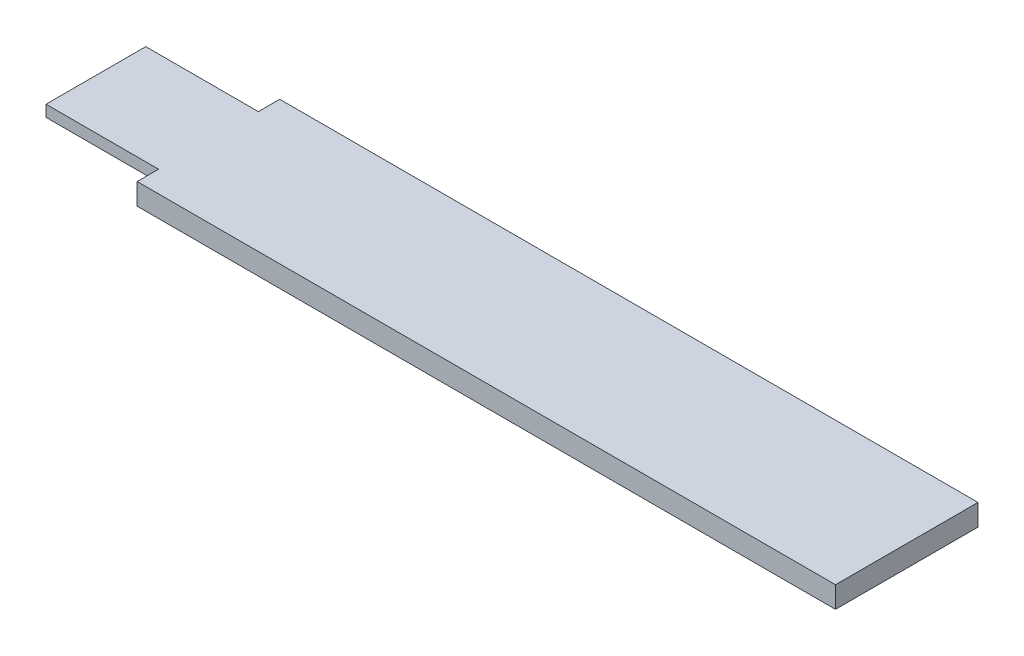
from build123d import *

# Parameters (mm, degrees)
EXTRUDE_1_DEPTH = 15
EXTRUDE_3_DEPTH = 89


with BuildPart() as part:
    # 草图1 → 凸台-拉伸1 (new body)
    with BuildSketch(Plane.XZ):
        Polygon((245, -50), (245, 50), (-245, 50), (-245, 35), (-235, 35), (-235, -35), (-245, -35), (-245, -50), align=None)
    extrude(amount=-EXTRUDE_1_DEPTH)

    # 草图2 → 凸台-拉伸3 (add)
    with BuildSketch(Plane.ZY.offset(235)):
        Polygon((-26.300861676, 7), (-35, 7), (-35, 15), (35, 15), (35, 7), align=None)
    extrude(amount=EXTRUDE_3_DEPTH)


solid = part.part
